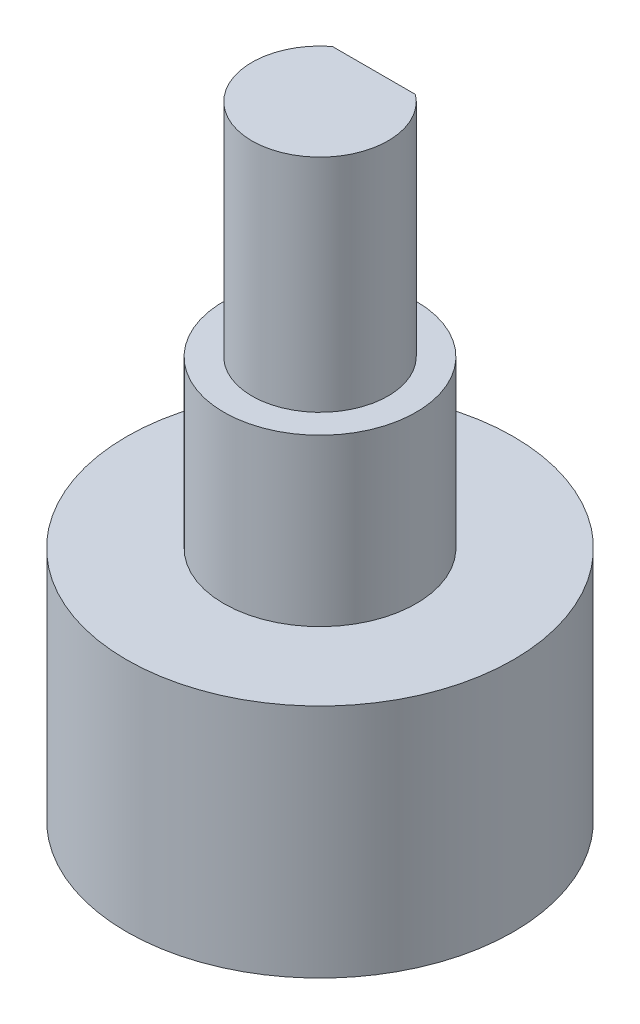
from build123d import *

# Parameters (mm, degrees)
SKETCH1_R           = 11.1125
BOSS_EXTRUDE1_DEPTH = 13.54
SKETCH2_R           = 5.5245
BOSS_EXTRUDE2_DEPTH = 9.525
BOSS_EXTRUDE3_DEPTH = 12.7


with BuildPart() as part:
    # Sketch1 → Boss-Extrude1 (new body)
    with BuildSketch(Plane(origin=(0, 0, 0), x_dir=(1, 0, 0), z_dir=(0, 1, 0))):
        with Locations(Location((0, 0, 0), (0, 0, 270))):
            Circle(SKETCH1_R)
    extrude(amount=BOSS_EXTRUDE1_DEPTH)

    # Sketch2 → Boss-Extrude2 (add)
    with BuildSketch(Plane(origin=(0, 13.54, 0), x_dir=(1, 0, 0), z_dir=(0, 1, 0))):
        with Locations(Location((0, 0, 0), (0, 0, 90))):
            Circle(SKETCH2_R)
    extrude(amount=BOSS_EXTRUDE2_DEPTH)

    # Sketch3 → Boss-Extrude3 (add)
    with BuildSketch(Plane(origin=(0, 23.065, 0), x_dir=(1, 0, 0), z_dir=(0, 1, 0))):
        with BuildLine():
            Line((2.387059513, 3.0988), (-2.387059513, 3.0988))
            ThreePointArc((-2.387059513, 3.0988), (0, -3.9116), (2.387059513, 3.0988))
        make_face()
    extrude(amount=BOSS_EXTRUDE3_DEPTH)


solid = part.part
